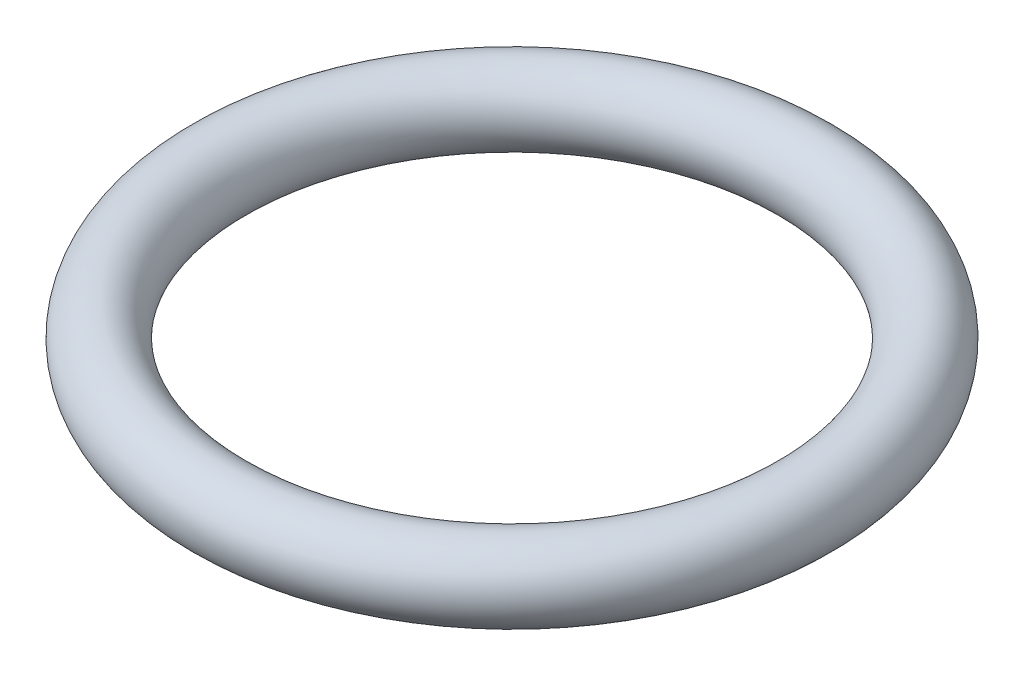
from build123d import *

# Parameters (mm, degrees)
SKETCH5_R = 0.75


with BuildPart() as part:
    # Sketch5 → Revolve1 (revolve)
    with BuildSketch(Plane.XY, mode=Mode.PRIVATE) as revolve1_sk:
        Circle(SKETCH5_R)
    revolve(revolve1_sk.sketch.rotate(Axis((5.875, 0, 0), (0, 1, 0)), 270), axis=Axis((5.875, 0, 0), (0, 1, 0)))


solid = part.part
